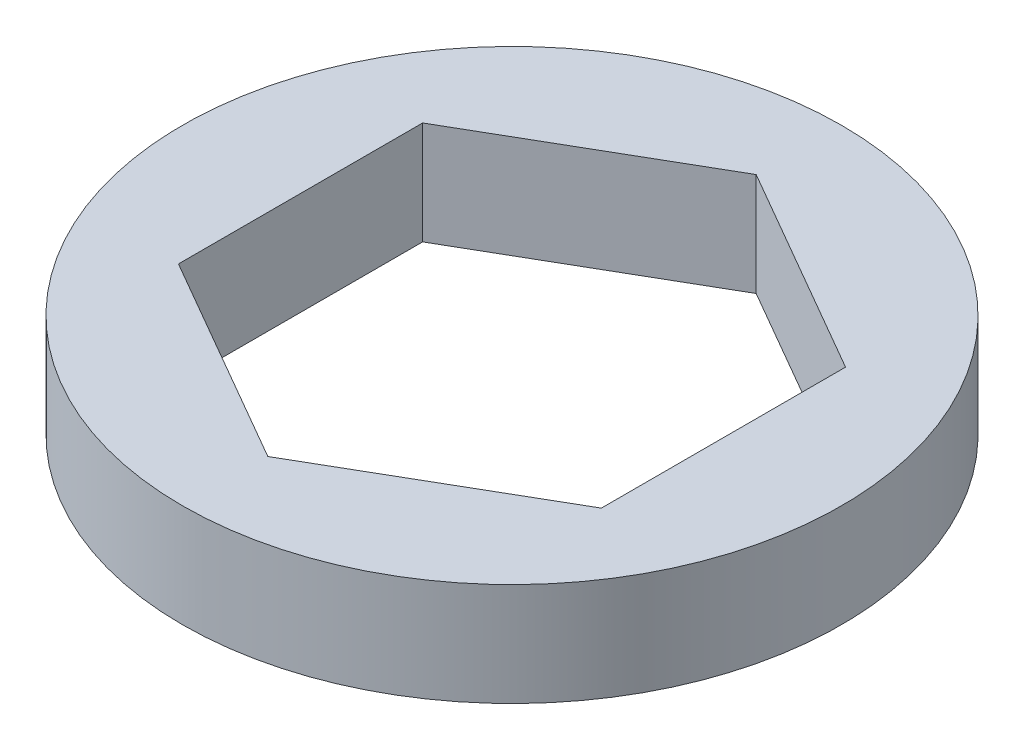
from build123d import *

# Parameters (mm, degrees)
SKETCH2_R           = 7.719231767
BOSS_EXTRUDE1_DEPTH = 2.413


with BuildPart() as part:
    # Sketch2 → Boss-Extrude1 (new body)
    with BuildSketch(Plane(origin=(0, 0, 0), x_dir=(1, 0, 0), z_dir=(0, 1, 0))):
        with Locations(Location((0, 0, 0), (0, 0, 270))):
            Circle(SKETCH2_R)
        Polygon((0, 5.719231767), (-4.953, 2.859615883), (-4.953, -2.859615883), (0, -5.719231767), (4.953, -2.859615883), (4.953, 2.859615883), align=None, mode=Mode.SUBTRACT)
    extrude(amount=BOSS_EXTRUDE1_DEPTH)


solid = part.part
